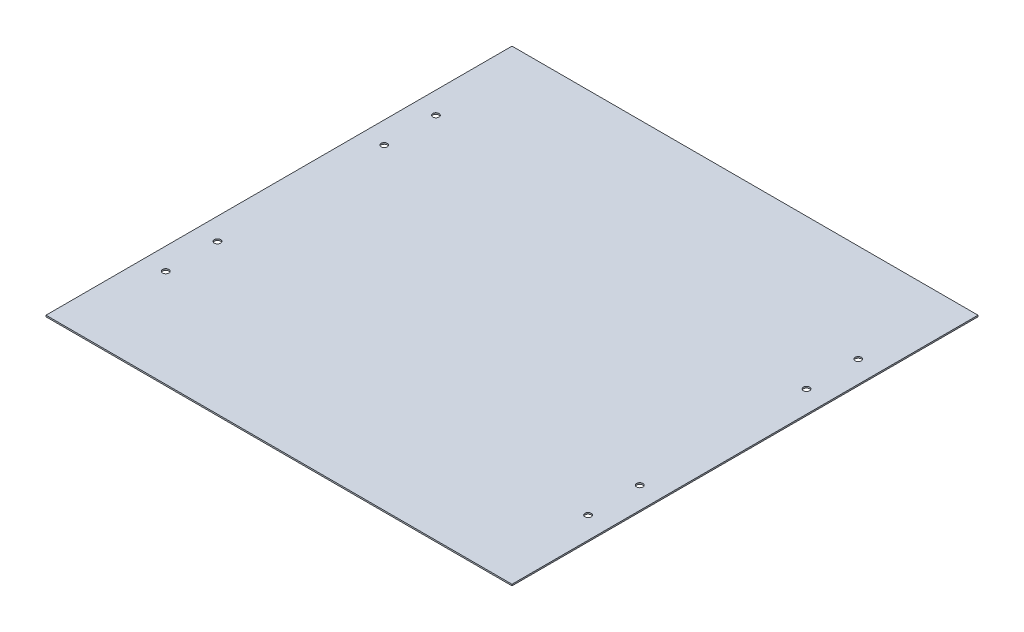
from build123d import *

# Parameters (mm, degrees)
SKIZZE1_W                       = 320
SKIZZE1_H                       = 320
AUFSATZ_LINEAR_AUSTRAGEN1_DEPTH = 1
SKIZZE2_R                       = 2.15
SCHNITT_LINEAR_AUSTRAGEN1_DEPTH = 2


with BuildPart() as part:
    # Skizze1 → Aufsatz-Linear austragen1 (new body)
    with BuildSketch(Plane(origin=(0, 0, 0), x_dir=(1, 0, 0), z_dir=(0, 1, 0))):
        Rectangle(SKIZZE1_W, SKIZZE1_H)
    extrude(amount=AUFSATZ_LINEAR_AUSTRAGEN1_DEPTH)

    # Skizze2 → Schnitt-Linear austragen1 (cut)
    with BuildSketch(Plane(origin=(0, 1, 0), x_dir=(1, 0, 0), z_dir=(0, 1, 0))):
        with Locations(Location((145, 92.75, 0), (0, 0, 270))):
            Circle(SKIZZE2_R)
        with Locations(Location((145, 57.25, 0), (0, 0, 90))):
            Circle(SKIZZE2_R)
        with Locations(Location((145, -57.25, 0), (0, 0, 270))):
            Circle(SKIZZE2_R)
        with Locations(Location((145, -92.75, 0), (0, 0, 90))):
            Circle(SKIZZE2_R)
        with Locations(Location((-145, 92.75, 0), (0, 0, 90))):
            Circle(SKIZZE2_R)
        with Locations(Location((-145, 57.25, 0), (0, 0, 270))):
            Circle(SKIZZE2_R)
        with Locations(Location((-145, -92.75, 0), (0, 0, 270))):
            Circle(SKIZZE2_R)
        with Locations(Location((-145, -57.25, 0), (0, 0, 90))):
            Circle(SKIZZE2_R)
    extrude(amount=-SCHNITT_LINEAR_AUSTRAGEN1_DEPTH, mode=Mode.SUBTRACT)


solid = part.part
